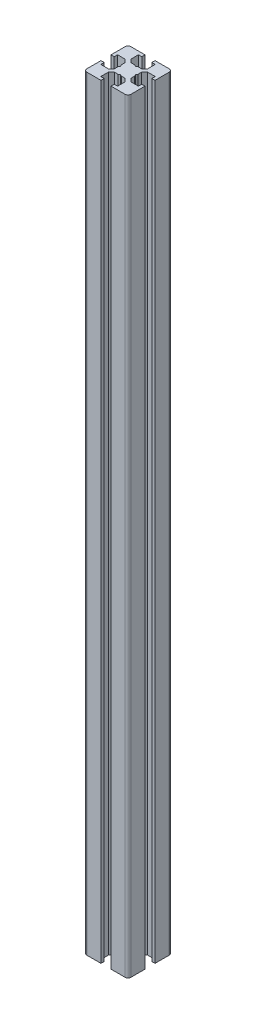
from build123d import *

# Parameters (mm, degrees)
BOSS_EXTRUDE1_DEPTH = 260


with BuildPart() as part:
    # Sketch2 → Boss-Extrude1 (new body)
    with BuildSketch(Plane(origin=(0, 0, 0), x_dir=(1, 0, 0), z_dir=(0, 1, 0))):
        with BuildLine():
            Line((1.7, 7.5), (6.5, 7.5))
            ThreePointArc((6.5, 7.5), (7.207106781, 7.207106781), (7.5, 6.5))
            Line((7.5, 6.5), (7.5, 1.7))
            Line((7.5, 1.7), (6.4, 1.7))
            Line((6.4, 1.7), (6.4, 2.85))
            Line((6.4, 2.85), (3.8, 2.85))
            Line((3.8, 2.85), (2.8, 1.85))
            Line((2.8, 1.85), (2.8, 0.519615242))
            Line((2.8, 0.519615242), (2.5, 0))
            Line((2.5, 0), (2.8, -0.519615242))
            Line((2.8, -0.519615242), (2.8, -1.85))
            Line((2.8, -1.85), (3.8, -2.85))
            Line((3.8, -2.85), (6.4, -2.85))
            Line((6.4, -2.85), (6.4, -1.7))
            Line((6.4, -1.7), (7.5, -1.7))
            Line((7.5, -1.7), (7.5, -6.5))
            ThreePointArc((7.5, -6.5), (7.207106781, -7.207106781), (6.5, -7.5))
            Line((6.5, -7.5), (1.7, -7.5))
            Line((1.7, -7.5), (1.7, -6.4))
            Line((1.7, -6.4), (2.85, -6.4))
            Line((2.85, -6.4), (2.85, -3.8))
            Line((2.85, -3.8), (1.85, -2.8))
            Line((1.85, -2.8), (0.519615242, -2.8))
            Line((0.519615242, -2.8), (0, -2.5))
            Line((0, -2.5), (-0.519615242, -2.8))
            Line((-0.519615242, -2.8), (-1.85, -2.8))
            Line((-1.85, -2.8), (-2.85, -3.8))
            Line((-2.85, -3.8), (-2.85, -6.4))
            Line((-2.85, -6.4), (-1.7, -6.4))
            Line((-1.7, -6.4), (-1.7, -7.5))
            Line((-1.7, -7.5), (-6.5, -7.5))
            ThreePointArc((-6.5, -7.5), (-7.207106781, -7.207106781), (-7.5, -6.5))
            Line((-7.5, -6.5), (-7.5, -1.7))
            Line((-7.5, -1.7), (-6.4, -1.7))
            Line((-6.4, -1.7), (-6.4, -2.85))
            Line((-6.4, -2.85), (-3.8, -2.85))
            Line((-3.8, -2.85), (-2.8, -1.85))
            Line((-2.8, -1.85), (-2.8, -0.519615242))
            Line((-2.8, -0.519615242), (-2.5, 0))
            Line((-2.5, 0), (-2.8, 0.519615242))
            Line((-2.8, 0.519615242), (-2.8, 1.85))
            Line((-2.8, 1.85), (-3.8, 2.85))
            Line((-3.8, 2.85), (-6.4, 2.85))
            Line((-6.4, 2.85), (-6.4, 1.7))
            Line((-6.4, 1.7), (-7.5, 1.7))
            Line((-7.5, 1.7), (-7.5, 6.5))
            ThreePointArc((-7.5, 6.5), (-7.207106781, 7.207106781), (-6.5, 7.5))
            Line((-6.5, 7.5), (-1.7, 7.5))
            Line((-1.7, 7.5), (-1.7, 6.4))
            Line((-1.7, 6.4), (-2.85, 6.4))
            Line((-2.85, 6.4), (-2.85, 3.8))
            Line((-2.85, 3.8), (-1.85, 2.8))
            Line((-1.85, 2.8), (-0.519615242, 2.8))
            Line((-0.519615242, 2.8), (0, 2.5))
            Line((0, 2.5), (0.519615242, 2.8))
            Line((0.519615242, 2.8), (1.85, 2.8))
            Line((1.85, 2.8), (2.85, 3.8))
            Line((2.85, 3.8), (2.85, 6.4))
            Line((2.85, 6.4), (1.7, 6.4))
            Line((1.7, 6.4), (1.7, 7.5))
        make_face()
    extrude(amount=BOSS_EXTRUDE1_DEPTH)


solid = part.part
